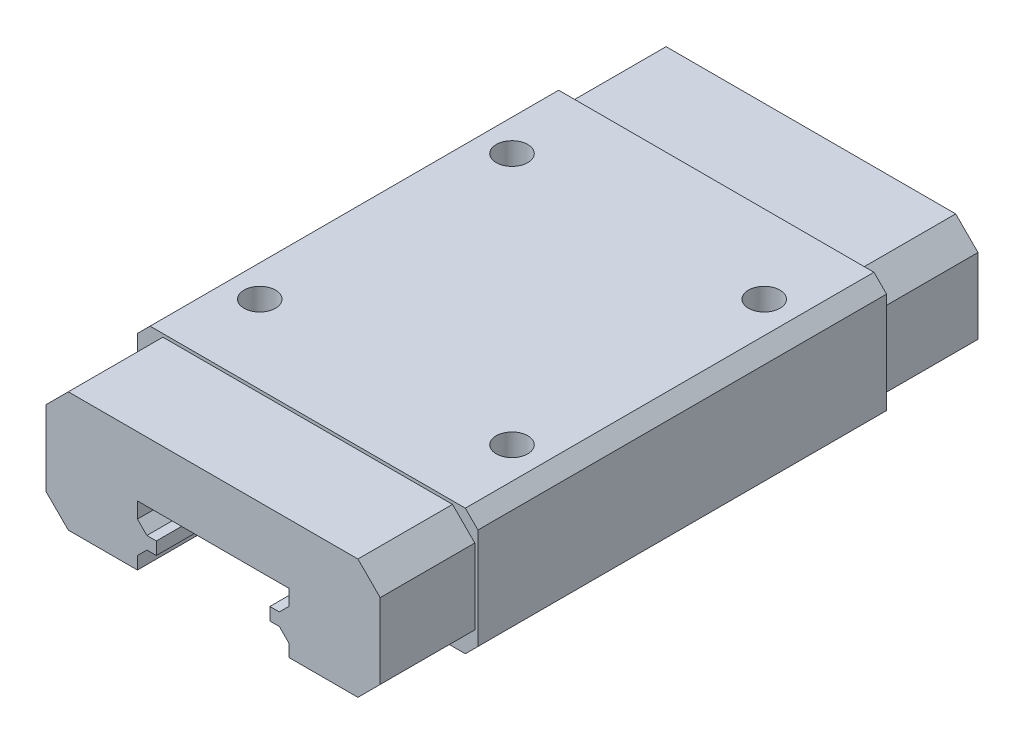
from build123d import *
from build123d.topology import SkipClean

# Parameters (mm, degrees)
BOSS_EXTRUDE1_DEPTH                  = 16.2
LPATTERN1_COUNT                      = 10
LPATTERN1_PITCH                      = 3.5
LPATTERN2_COUNT                      = 10
LPATTERN2_PITCH                      = 3.5
BOSS_EXTRUDE3_DEPTH                  = 7.5
LPATTERN3_COUNT                      = 2
LPATTERN3_PITCH                      = 39.9
TAP_DRILL_FOR_M3X0_5_TAP1_AT_2_COUNT = 2
TAP_DRILL_FOR_M3X0_5_TAP1_AT_2_PITCH = 20
TAP_DRILL_FOR_M3X0_5_TAP1_AT_3_COUNT = 2
TAP_DRILL_FOR_M3X0_5_TAP1_AT_3_PITCH = 20
TAP_DRILL_FOR_M3X0_5_TAP1_AT_4_COUNT = 2
TAP_DRILL_FOR_M3X0_5_TAP1_AT_4_PITCH = 28.284271247


with BuildPart() as part:
    # Sketch1 → Boss-Extrude1 (new, symmetric)
    with BuildSketch(Plane.XY):
        Polygon((6.5, 0), (12.5, 0), (13.5, 1), (13.5, 9), (12.5, 10), (-12.5, 10), (-13.5, 9), (-13.5, 1), (-12.5, 0), (-6.5, 0), (-6.5, 5.5), (6.5, 5.5), align=None)
    extrude(amount=BOSS_EXTRUDE1_DEPTH, both=True)

    # Sketch3 → Revolve1 (revolve)
    with SkipClean():  # the faces are left unmerged after this step: merging them gives an invalid solid
        with BuildSketch(Plane.XY.offset(16.2)):
            with BuildLine():
                ThreePointArc((-6.5, 1.262563133), (-5.625, 1.625), (-5.262563133, 2.5))
                ThreePointArc((-5.262563133, 2.5), (-5.625, 3.375), (-6.5, 3.737436867))
                Line((-6.5, 3.737436867), (-6.5, 1.262563133))
            make_face()
        revolve1 = revolve(axis=Axis((-6.5, 0, 16.2), (0, 1, 0)))

    # Sketch3<3> → Revolve2 (revolve)
    with SkipClean():  # the faces are left unmerged after this step: merging them gives an invalid solid
        with BuildSketch(Plane.XY.offset(16.2)):
            with BuildLine():
                Line((6.5, 1.262563133), (6.5, 3.737436867))
                ThreePointArc((6.5, 3.737436867), (5.262563133, 2.5), (6.5, 1.262563133))
            make_face()
        revolve2 = revolve(axis=Axis((6.5, 0, 16.2), (0, -1, 0)))

    # LPattern1: Revolve1 ×10
    with SkipClean():  # the faces are left unmerged after this step: merging them gives an invalid solid
        with Locations(*[(0, 0, -i * LPATTERN1_PITCH) for i in range(1, LPATTERN1_COUNT)]):
            add(revolve1)

    # LPattern2: Revolve2 ×10
    with SkipClean():  # the faces are left unmerged after this step: merging them gives an invalid solid
        with Locations(*[(0, 0, -i * LPATTERN2_PITCH) for i in range(1, LPATTERN2_COUNT)]):
            add(revolve2)

    # Sketch6 → Tap Drill for M3x0.5 Tap1 (revolve, cut)
    with SkipClean():  # the faces are left unmerged after this step: merging them gives an invalid solid
        with BuildSketch(Plane(origin=(-10, 10, -10), x_dir=(0, 0, 1), z_dir=(1, 0, 0))):
            Polygon((0, 0), (0, 4.251075774), (1.25, 3.5), (1.25, 0), align=None)
        tap_drill_for_m3x0_5_tap1 = revolve(axis=Axis((-10, 16.35, -10), (0, -1, 0)), mode=Mode.SUBTRACT)

    # Tap Drill for M3x0.5 Tap1 at 2: Tap Drill for M3x0.5 Tap1 ×2
    with SkipClean():  # the faces are left unmerged after this step: merging them gives an invalid solid
        with Locations(*[(i * TAP_DRILL_FOR_M3X0_5_TAP1_AT_2_PITCH, 0, 0) for i in range(1, TAP_DRILL_FOR_M3X0_5_TAP1_AT_2_COUNT)]):
            add(tap_drill_for_m3x0_5_tap1, mode=Mode.SUBTRACT)

    # Tap Drill for M3x0.5 Tap1 at 3: Tap Drill for M3x0.5 Tap1 ×2
    with SkipClean():  # the faces are left unmerged after this step: merging them gives an invalid solid
        with Locations(*[(0, 0, i * TAP_DRILL_FOR_M3X0_5_TAP1_AT_3_PITCH) for i in range(1, TAP_DRILL_FOR_M3X0_5_TAP1_AT_3_COUNT)]):
            add(tap_drill_for_m3x0_5_tap1, mode=Mode.SUBTRACT)

    # Tap Drill for M3x0.5 Tap1 at 4: Tap Drill for M3x0.5 Tap1 ×2
    with SkipClean():  # the faces are left unmerged after this step: merging them gives an invalid solid
        with Locations(*[Vector(0.7071067811865476, 0, 0.7071067811865476) * (i * TAP_DRILL_FOR_M3X0_5_TAP1_AT_4_PITCH) for i in range(1, TAP_DRILL_FOR_M3X0_5_TAP1_AT_4_COUNT)]):
            add(tap_drill_for_m3x0_5_tap1, mode=Mode.SUBTRACT)


with BuildPart() as body_2:
    # Sketch4 → Boss-Extrude3 (new body)
    with BuildSketch(Plane.XY.offset(16.2)):
        Polygon((-6, 0.25), (-11.482233047, 0.25), (-13.25, 2.017766953), (-13.25, 7.982233047), (-11.482233047, 9.75), (11.482233047, 9.75), (13.25, 7.982233047), (13.25, 2.017766953), (11.482233047, 0.25), (6, 0.25), (6, 1.25), (5.25, 2), (4.5, 2), (4.5, 3), (5.25, 3), (6, 3.75), (6, 5), (-6, 5), (-6, 3.75), (-5.25, 3), (-4.5, 3), (-4.5, 2), (-5.25, 2), (-6, 1.25), align=None)
    boss_extrude3 = extrude(amount=BOSS_EXTRUDE3_DEPTH)


with BuildPart() as lpattern3_1:
    # LPattern3: Boss-Extrude3 ×2
    with Locations(*[(0, 0, -i * LPATTERN3_PITCH) for i in range(1, LPATTERN3_COUNT)]):
        add(boss_extrude3)


solid = Compound([part.part, body_2.part, lpattern3_1.part])
